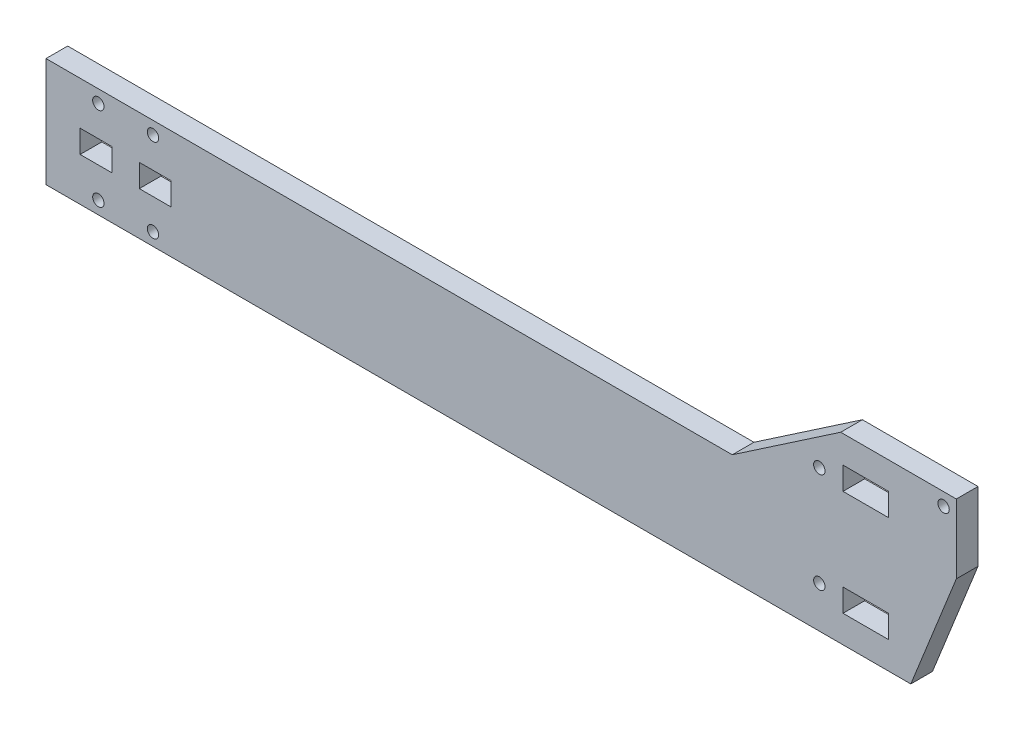
from build123d import *

# Parameters (mm, degrees)
BOSS_EXTRUDE1_DEPTH = 4.7625
SKETCH2_R           = 1.25
SKETCH2_W           = 10
SKETCH2_H           = 5
SKETCH2_W_2         = 7
CUT_EXTRUDE1_DEPTH  = 205.055682122


with BuildPart() as part:
    # Sketch1 → Boss-Extrude1 (new body)
    with BuildSketch(Plane.XY):
        Polygon((174.6, 40.2), (150.776470588, 24), (0, 24), (0, 0), (190, 0), (200, 25), (200, 40.2), align=None)
    extrude(amount=BOSS_EXTRUDE1_DEPTH)

    # Sketch2 → Cut-Extrude1 (cut, through all)
    with BuildSketch(Plane.XY.offset(4.7625)):
        with Locations((169.9, 31.1)):
            Circle(SKETCH2_R)
        with Locations((197.2, 37.4)):
            Circle(SKETCH2_R)
        with Locations((169.9, 9.1)):
            Circle(SKETCH2_R)
        with Locations((23.5, 21.2)):
            Circle(SKETCH2_R)
        with Locations((11.5, 21.2)):
            Circle(SKETCH2_R)
        with Locations((11.5, 2.8)):
            Circle(SKETCH2_R)
        with Locations((23.5, 2.8)):
            Circle(SKETCH2_R)
        with Locations((180.1, 31.7)):
            Rectangle(SKETCH2_W, SKETCH2_H)
        with Locations((180.1, 8.5)):
            Rectangle(SKETCH2_W, SKETCH2_H)
        with Locations((11, 12)):
            Rectangle(SKETCH2_W_2, SKETCH2_H)
        with Locations((24, 12)):
            Rectangle(SKETCH2_W_2, SKETCH2_H)
    extrude(amount=-CUT_EXTRUDE1_DEPTH, mode=Mode.SUBTRACT)


solid = part.part
